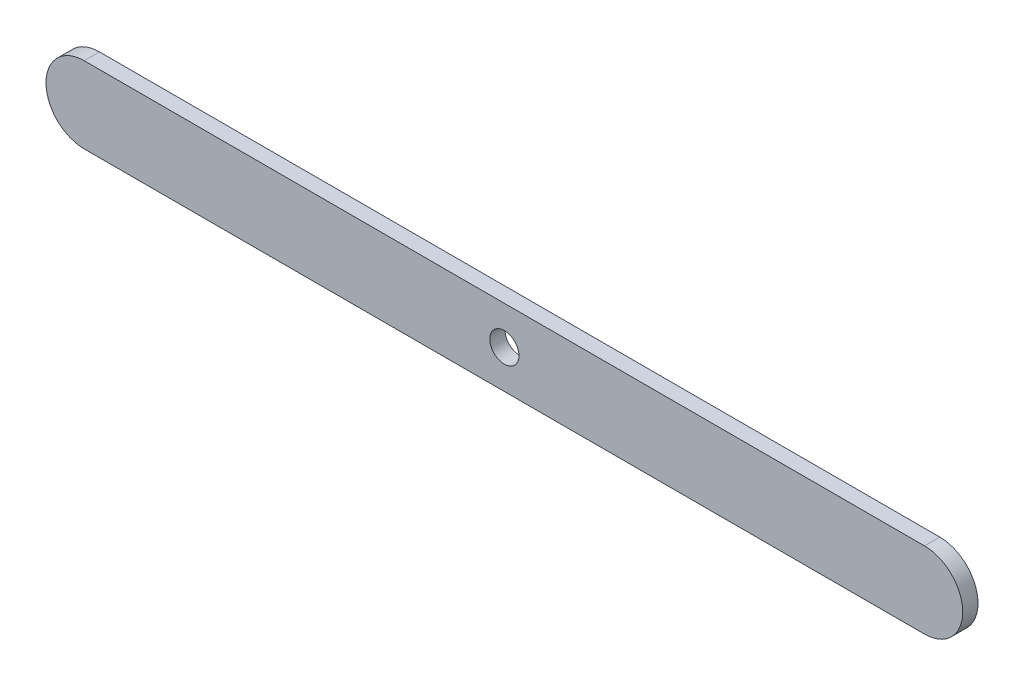
from build123d import *

# Parameters (mm, degrees)
SKETCH1_R           = 2.4257
BOSS_EXTRUDE1_DEPTH = 2.54


with BuildPart() as part:
    # Sketch1 → Boss-Extrude1 (new body)
    with BuildSketch(Plane.XY):
        with BuildLine():
            Line((0, 6.35), (139.7, 6.35))
            ThreePointArc((139.7, 6.35), (146.05, 0), (139.7, -6.35))
            Line((139.7, -6.35), (0, -6.35))
            ThreePointArc((0, -6.35), (-6.35, 0), (0, 6.35))
        make_face()
        with Locations((69.85, 0)):
            Circle(SKETCH1_R, mode=Mode.SUBTRACT)
    extrude(amount=BOSS_EXTRUDE1_DEPTH)


solid = part.part
